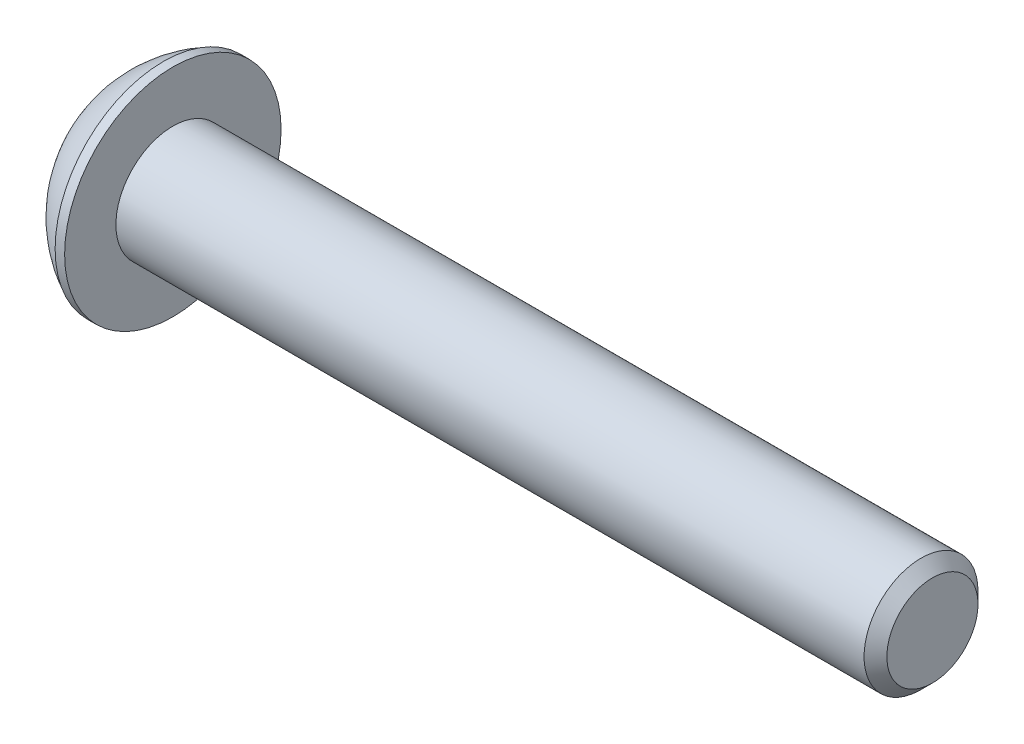
from build123d import *

# Parameters (mm, degrees)
SKETCH2_R           = 1.5
BOSS_EXTRUDE1_DEPTH = 20
CHAMFER1_SIZE       = 0.3
CUT_EXTRUDE1_DEPTH  = 1.2
SKETCH8_R           = 1.204700538
CUT_EXTRUDE2_DEPTH  = 1
CUT_EXTRUDE2_DRAFT  = -45


with BuildPart() as part:
    # Sketch2 → Boss-Extrude1 (new body)
    with BuildSketch(Plane(origin=(0, 0, 0), x_dir=(0, 0, -1), z_dir=(1, 0, 0))):
        Circle(SKETCH2_R)
    extrude(amount=-BOSS_EXTRUDE1_DEPTH)

    # Chamfer1
    chamfer1_edges = [part.edges().sort_by_distance(p)[0] for p in [
        (0, 0, 1.5),
    ]]
    chamfer(chamfer1_edges, length=CHAMFER1_SIZE)

    # Sketch6 → Revolve1 (revolve)
    with BuildSketch(Plane.XY):
        with BuildLine():
            Line((-21.65, 0), (-21.65, 1.5))
            ThreePointArc((-21.65, 1.5), (-21.055944823, 2.284868705), (-20.25, 2.85))
            Line((-20.25, 2.85), (-20, 2.85))
            Line((-20, 2.85), (-20, 0))
            Line((-20, 0), (-21.65, 0))
        make_face()
    revolve(axis=Axis((-20, 0, 0), (1, 0, 0)))

    # Sketch7 → Cut-Extrude1 (cut)
    with BuildSketch(Plane.ZY.offset(21.65)):
        Polygon((0, 1.154700538), (-1, 0.577350269), (-1, -0.577350269), (0, -1.154700538), (1, -0.577350269), (1, 0.577350269), align=None)
    extrude(amount=-CUT_EXTRUDE1_DEPTH, mode=Mode.SUBTRACT)


with BuildPart() as cut_extrude2_tool:
    # Sketch8 → Cut-Extrude2 (with draft: the straight prism first)
    with BuildSketch(Plane.ZY.offset(21.65)):
        Circle(SKETCH8_R)
    extrude(amount=-CUT_EXTRUDE2_DEPTH)
    # Cut-Extrude2: the draft: its side faces are tilted about the plane it starts from
    cut_extrude2_sides = [cut_extrude2_tool.faces().sort_by_distance(p)[0] for p in [
        (-21.15, 0, -1.204700538),
    ]]
    draft(cut_extrude2_sides, Plane.ZY.offset(21.65), CUT_EXTRUDE2_DRAFT)


with BuildPart() as part_1:
    add(part.part)

    # Cut-Extrude2: cut by cut_extrude2_tool
    add(cut_extrude2_tool.part, mode=Mode.SUBTRACT)


solid = part_1.part
